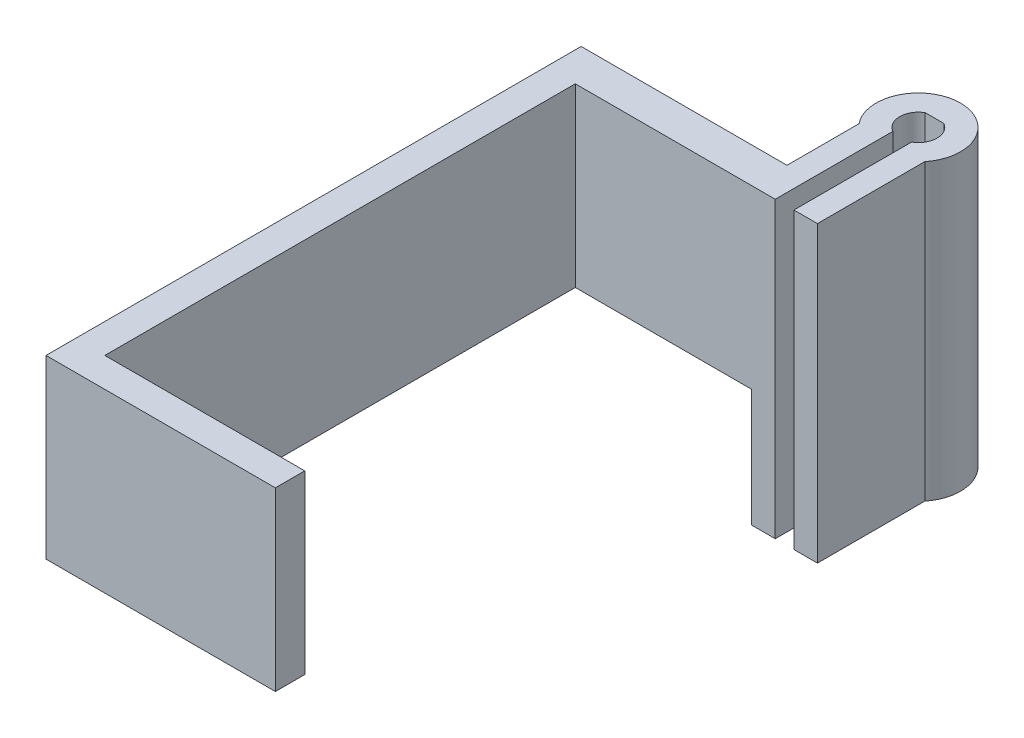
from build123d import *

# Parameters (mm, degrees)
BOSS_EXTRUDE1_DEPTH = 50
BOSS_EXTRUDE2_DEPTH = 30


with BuildPart() as part:
    # Sketch1 → Boss-Extrude1 (new body)
    with BuildSketch(Plane(origin=(0, 0, 0), x_dir=(1, 0, 0), z_dir=(0, 1, 0))):
        with BuildLine():
            Line((-1.5875, -2.749630657), (-1.5875, -22.749630657))
            Line((-1.5875, -22.749630657), (-5.5875, -22.749630657))
            Line((-5.5875, -22.749630657), (-5.5875, -4.501163044))
            ThreePointArc((-5.5875, -4.501163044), (0, 7.175), (5.5875, -4.501163044))
            Line((5.5875, -4.501163044), (5.5875, -22.749630657))
            Line((5.5875, -22.749630657), (1.5875, -22.749630657))
            Line((1.5875, -22.749630657), (1.5875, -2.749630657))
            ThreePointArc((1.5875, -2.749630657), (3.175, 0), (1.5875, 2.749630657))
            Line((1.5875, 2.749630657), (-1.5875, 2.749630657))
            ThreePointArc((-1.5875, 2.749630657), (-3.175, 0), (-1.5875, -2.749630657))
        make_face()
    extrude(amount=BOSS_EXTRUDE1_DEPTH)

    # Sketch5 → Boss-Extrude2 (add)
    with BuildSketch(Plane(origin=(0, 50, 0), x_dir=(1, 0, 0), z_dir=(0, 1, 0))):
        Polygon((-5.5875, -22.749630657), (-35.5875, -22.749630657), (-35.5875, -102.749630657), (-1.5875, -102.749630657), (-1.5875, -107.749630657), (-40.5875, -107.749630657), (-40.5875, -16.749630657), (-5.5875, -16.749630657), align=None)
    extrude(amount=-BOSS_EXTRUDE2_DEPTH)


solid = part.part
